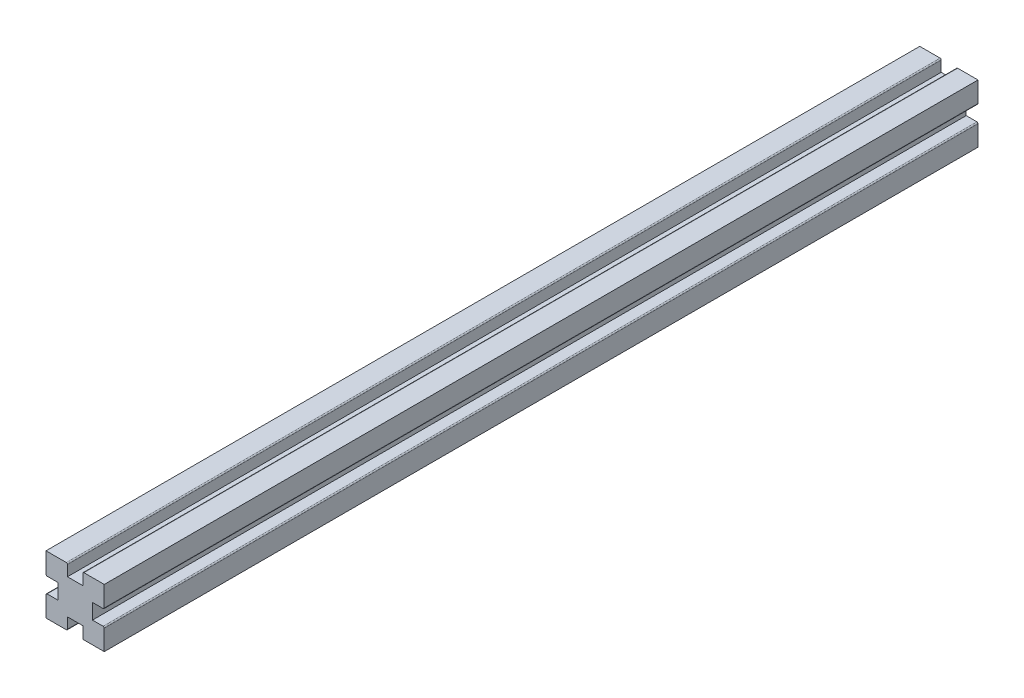
from build123d import *

# Parameters (mm, degrees)
BOSS_EXTRUDE1_DEPTH = 381
FILLET1_R           = 0.5


with BuildPart() as part:
    # Sketch1 → Boss-Extrude1 (new body)
    with BuildSketch(Plane.XY):
        Polygon((7.568163265, 3.34), (12.7, 3.34), (12.7, 12.7), (3.34, 12.7), (3.34, 7.568163265), (-3.34, 7.568163265), (-3.34, 12.7), (-12.7, 12.7), (-12.7, 3.34), (-7.568163265, 3.34), (-7.568163265, -3.34), (-12.7, -3.34), (-12.7, -12.7), (-3.34, -12.7), (-3.34, -7.568163265), (3.34, -7.568163265), (3.34, -12.7), (12.7, -12.7), (12.7, -3.34), (7.568163265, -3.34), align=None)
    extrude(amount=BOSS_EXTRUDE1_DEPTH)

    # Fillet1
    fillet1_edges = [part.edges().sort_by_distance(p)[0] for p in [
        (-12.7, 3.34, 190.5),
        (-3.34, 12.7, 190.5),
        (3.34, 12.7, 190.5),
        (12.7, 3.34, 190.5),
        (12.7, -3.34, 190.5),
        (3.34, -12.7, 190.5),
        (-3.34, -12.7, 190.5),
        (-12.7, -3.34, 190.5),
    ]]
    fillet(fillet1_edges, radius=FILLET1_R)


solid = part.part
